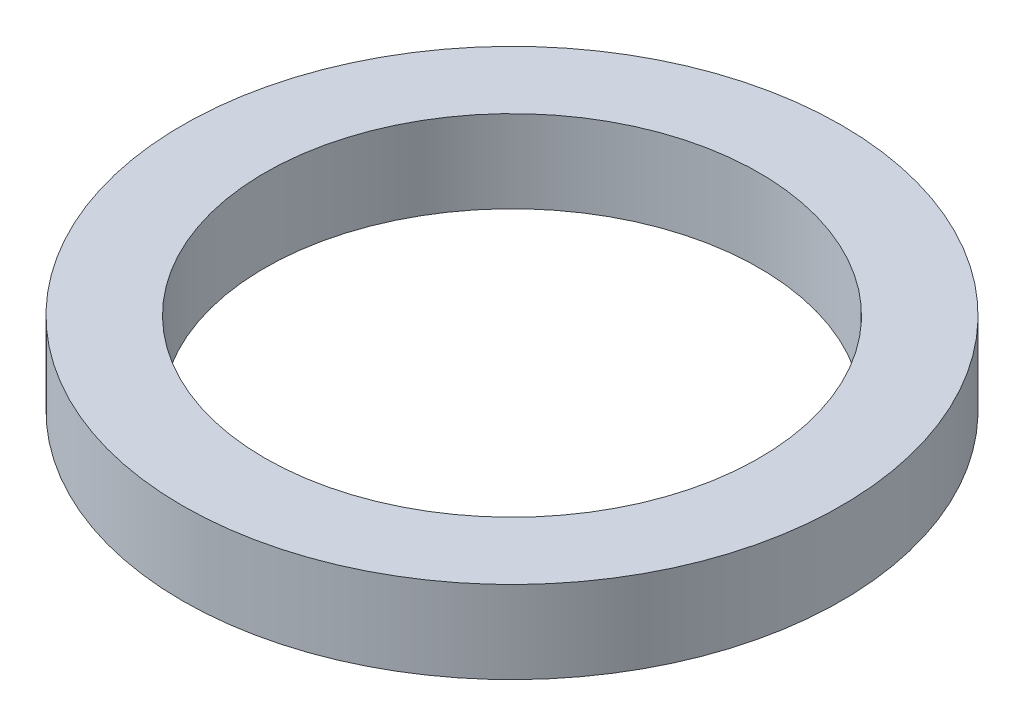
from build123d import *

# Parameters (mm, degrees)
SKETCH1_R           = 12.7
SKETCH1_R_2         = 9.525
BOSS_EXTRUDE1_DEPTH = 3.175


with BuildPart() as part:
    # Sketch1 → Boss-Extrude1 (new body)
    with BuildSketch(Plane(origin=(0, 0, 0), x_dir=(1, 0, 0), z_dir=(0, 1, 0))):
        with Locations(Location((0, 0, 0), (0, 0, 270))):
            Circle(SKETCH1_R)
        with Locations(Location((0, 0, 0), (0, 0, 270))):
            Circle(SKETCH1_R_2, mode=Mode.SUBTRACT)
    extrude(amount=BOSS_EXTRUDE1_DEPTH)


solid = part.part
